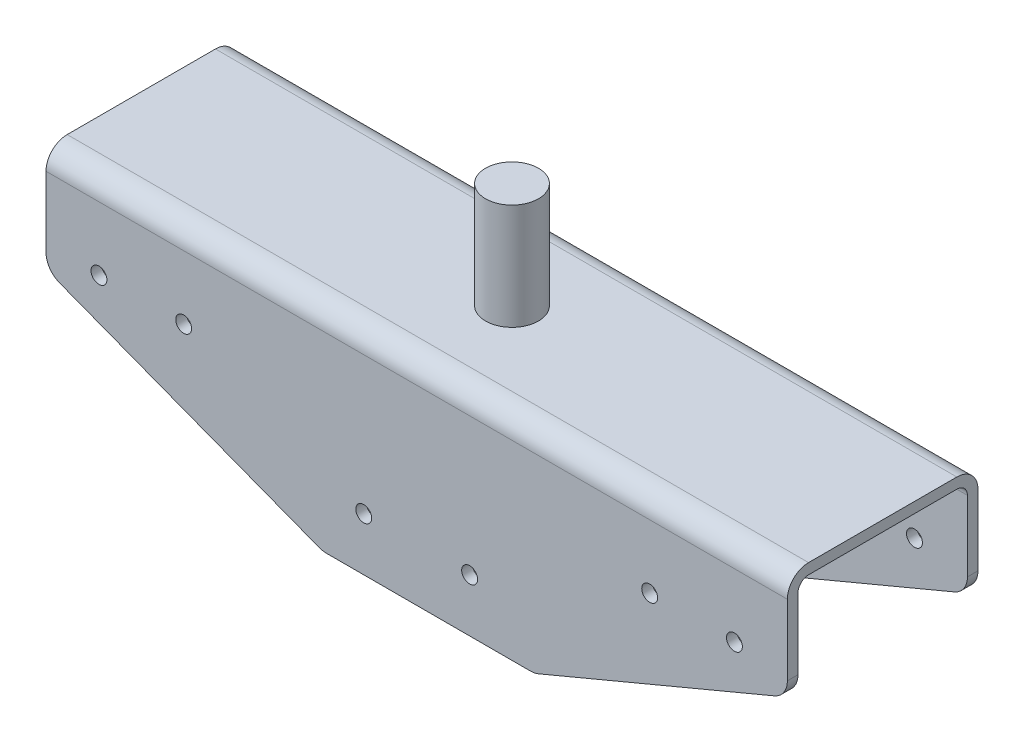
from build123d import *

# Parameters (mm, degrees)
BOSS_EXTRUDE1_DEPTH     = 9
FILLET1_R               = 2
CUT_EXTRUDE1_DEPTH      = 38.496666519
CUT_EXTRUDE1_DEPTH_BACK = 38.496666519
SKETCH3_R               = 2.5
BOSS_EXTRUDE2_DEPTH     = 10
CUT_EXTRUDE2_DEPTH      = 42.303752856
CUT_EXTRUDE2_DEPTH_BACK = 42.303752856
SKETCH4_R               = 0.75


with BuildPart() as part:
    # Sketch1 → Boss-Extrude1 (new, symmetric)
    with BuildSketch(Plane.XY):
        with BuildLine():
            ThreePointArc((-33.714795211, -0.491812162), (-34.647663561, 0.242423764), (-35, 1.376092494))
            Line((-35, 1.376092494), (-35, 10))
            Line((-35, 10), (35, 10))
            Line((35, 10), (35, 1.330500849))
            ThreePointArc((35, 1.330500849), (34.665188238, 0.222733667), (33.772851869, -0.514140034))
            Line((33.772851869, -0.514140034), (11.50283608, -9.844640883))
            ThreePointArc((11.50283608, -9.844640883), (11.12414042, -9.960775582), (10.729984211, -10))
            Line((10.729984211, -10), (-8.498371341, -10))
            ThreePointArc((-8.498371341, -10), (-8.861820571, -9.966698924), (-9.213166552, -9.867904657))
            Line((-9.213166552, -9.867904657), (-33.714795211, -0.491812162))
        make_face()
    extrude(amount=BOSS_EXTRUDE1_DEPTH, both=True)

    # Fillet1
    fillet1_edges = [part.edges().sort_by_distance(p)[0] for p in [
        (0, 10, -9),
        (0, 10, 9),
    ]]
    fillet(fillet1_edges, radius=FILLET1_R)

    # Sketch2 → Cut-Extrude1 (cut, two sides: drawn at the far end of the back side and taken through both)
    with BuildSketch(Plane(origin=(0, 0, 0), x_dir=(0, 0, -1), z_dir=(1, 0, 0)).offset(-CUT_EXTRUDE1_DEPTH_BACK)):
        with BuildLine():
            Line((-8, 8), (-8, -14.234256749))
            Line((-8, -14.234256749), (8, -14.234256749))
            Line((8, -14.234256749), (8, 1.330500849))
            Line((8, 1.330500849), (8, 8))
            ThreePointArc((8, 8), (7.707106781, 8.707106781), (7, 9))
            Line((7, 9), (-7, 9))
            ThreePointArc((-7, 9), (-7.707106781, 8.707106781), (-8, 8))
        make_face()
    extrude(amount=CUT_EXTRUDE1_DEPTH + CUT_EXTRUDE1_DEPTH_BACK, mode=Mode.SUBTRACT)

    # Sketch3 → Boss-Extrude2 (add)
    with BuildSketch(Plane(origin=(0, 10, 0), x_dir=(1, 0, 0), z_dir=(0, 1, 0))):
        with Locations(Location((0, 0, 0), (0, 0, 270))):
            Circle(SKETCH3_R)
    extrude(amount=BOSS_EXTRUDE2_DEPTH)

    # Sketch4 → Cut-Extrude2 (cut, two sides: drawn at the far end of the back side and taken through both)
    with BuildSketch(Plane.XY.offset(-CUT_EXTRUDE2_DEPTH_BACK)):
        with Locations((-30, 2)):
            Circle(SKETCH4_R)
        with Locations((-22, 2)):
            Circle(SKETCH4_R)
        with Locations((-5, -5)):
            Circle(SKETCH4_R)
        with Locations(Location((5, -5, 0), (0, 0, 180))):
            Circle(SKETCH4_R)
        with Locations(Location((22, 2, 0), (0, 0, 180))):
            Circle(SKETCH4_R)
        with Locations(Location((30, 2, 0), (0, 0, 180))):
            Circle(SKETCH4_R)
    extrude(amount=CUT_EXTRUDE2_DEPTH + CUT_EXTRUDE2_DEPTH_BACK, mode=Mode.SUBTRACT)


solid = part.part
